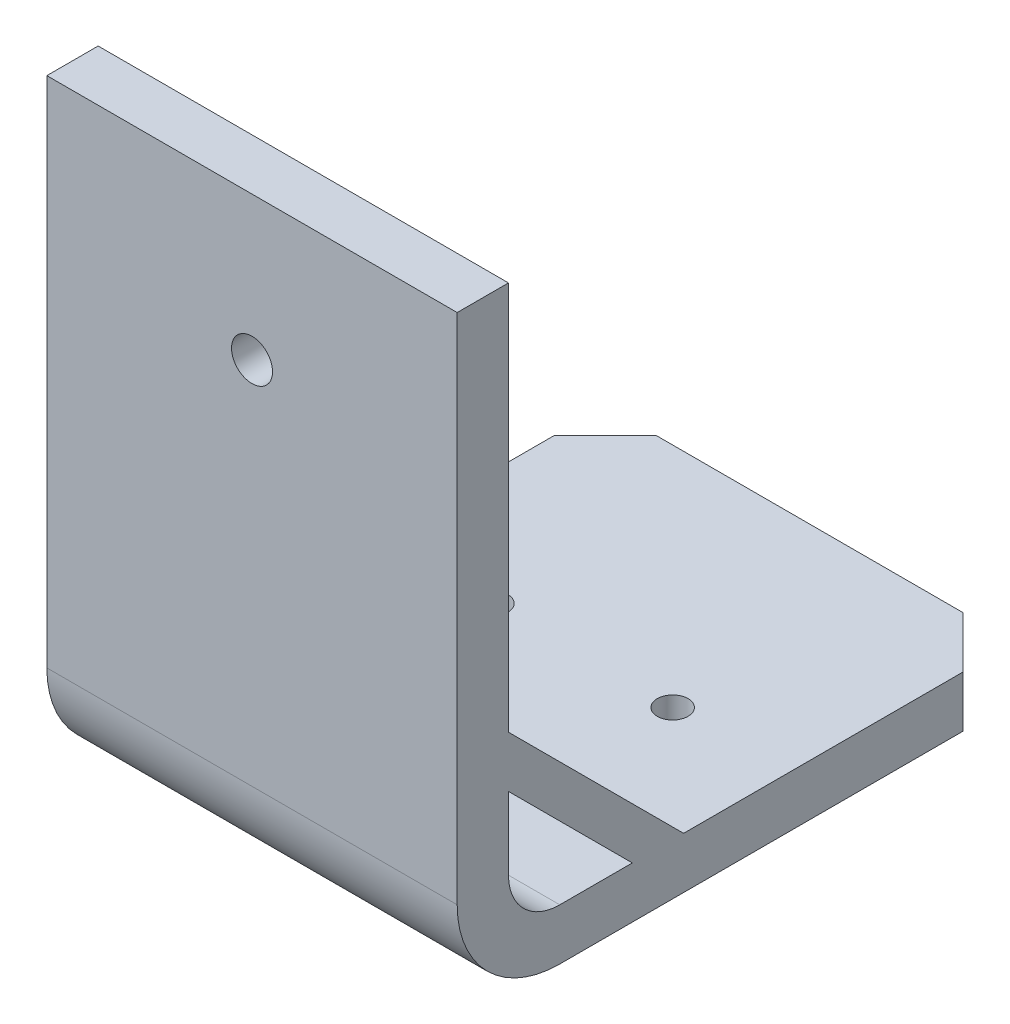
from build123d import *

# Parameters (mm, degrees)
BOSS_EXTRUDE1_DEPTH = 5
SKETCH2_R           = 1.5
CUT_EXTRUDE1_DEPTH  = 5
SKETCH1_4_OUTSIDE_W = 53.856
SKETCH1_4_OUTSIDE_H = 58.288
SKETCH1_4_OUTSIDE_R = 1.5
CUT_EXTRUDE3_DEPTH  = 31.230173018
BOSS_EXTRUDE2_DEPTH = 40
SKETCH5_W           = 5
SKETCH5_H           = 50
BOSS_EXTRUDE3_DEPTH = 40
BOSS_EXTRUDE4_DEPTH = 40
SKETCH9_R           = 2
CUT_EXTRUDE4_DEPTH  = 84.384553352


with BuildPart() as part:
    # Sketch1 → Boss-Extrude1 (new body)
    with BuildSketch(Plane(origin=(0, 0, 0), x_dir=(1, 0, 0), z_dir=(0, 1, 0))):
        Polygon((-14.94438846, 22.160431622), (14.94438846, 22.160431622), (19.94438846, 17.160431622), (19.94438846, -22.160431622), (-19.94438846, -22.160431622), (-19.94438846, 17.160431622), align=None)
    extrude(amount=BOSS_EXTRUDE1_DEPTH)

    # Sketch2 → Cut-Extrude1 (cut)
    with BuildSketch(Plane.XZ):
        with Locations((-8.780710157, 0)):
            Circle(SKETCH2_R)
    extrude(amount=-CUT_EXTRUDE1_DEPTH, mode=Mode.SUBTRACT)

    # Sketch1<4> outside → Cut-Extrude3 (cut, through all)
    # profile 1 of 3: a face of its own
    with BuildSketch(Plane(origin=(0, 0, 0), x_dir=(1, 0, 0), z_dir=(0, 1, 0))):
        Rectangle(SKETCH1_4_OUTSIDE_W, SKETCH1_4_OUTSIDE_H)
        Polygon((-14.94438846, 22.160431622), (14.94438846, 22.160431622), (19.94438846, 17.160431622), (19.94438846, -22.160431622), (-19.94438846, -22.160431622), (-19.94438846, 17.160431622), align=None, mode=Mode.SUBTRACT)
    # profile 2 of 3: a face of its own
    with BuildSketch(Plane(origin=(0, 0, 0), x_dir=(1, 0, 0), z_dir=(0, 1, 0))):
        with Locations((8.788189679, 0)):
            Circle(SKETCH1_4_OUTSIDE_R)
    # profile 3 of 3: a face of its own
    with BuildSketch(Plane(origin=(0, 0, 0), x_dir=(1, 0, 0), z_dir=(0, 1, 0))):
        with Locations((-8.788189679, 0)):
            Circle(SKETCH1_4_OUTSIDE_R)
    extrude(amount=CUT_EXTRUDE3_DEPTH, mode=Mode.SUBTRACT)

    # Sketch4 → Boss-Extrude2 (add)
    with BuildSketch(Plane(origin=(19.94438846, 0, 0), x_dir=(0, 0, -1), z_dir=(1, 0, 0))):
        with BuildLine():
            Line((-22.160431622, 5), (-22.160431622, 0))
            ThreePointArc((-22.160431622, 0), (-29.231499434, 2.928932188), (-32.160431622, 10))
            Line((-32.160431622, 10), (-27.160431622, 10))
            ThreePointArc((-27.160431622, 10), (-25.695965528, 6.464466094), (-22.160431622, 5))
        make_face()
    extrude(amount=-BOSS_EXTRUDE2_DEPTH)

    # Sketch5 → Boss-Extrude3 (add)
    with BuildSketch(Plane(origin=(19.94438846, 0, 0), x_dir=(0, 0, -1), z_dir=(1, 0, 0))):
        with Locations((-29.660431622, 35)):
            Rectangle(SKETCH5_W, SKETCH5_H)
    extrude(amount=-BOSS_EXTRUDE3_DEPTH)

    # Sketch6 → Boss-Extrude4 (add)
    with BuildSketch(Plane(origin=(19.94438846, 0, 0), x_dir=(0, 0, -1), z_dir=(1, 0, 0))):
        Polygon((-10.08936381, 5), (-18.624897716, 13.535533906), (-27.160431622, 22.071067812), (-27.160431622, 17.071067812), (-15.08936381, 5), align=None)
    extrude(amount=-BOSS_EXTRUDE4_DEPTH)

    # Sketch9 → Cut-Extrude4 (cut, through all)
    with BuildSketch(Plane.XY.offset(32.160431622)):
        with Locations((-0.05561154, 46)):
            Circle(SKETCH9_R)
    extrude(amount=-CUT_EXTRUDE4_DEPTH, mode=Mode.SUBTRACT)


solid = part.part
